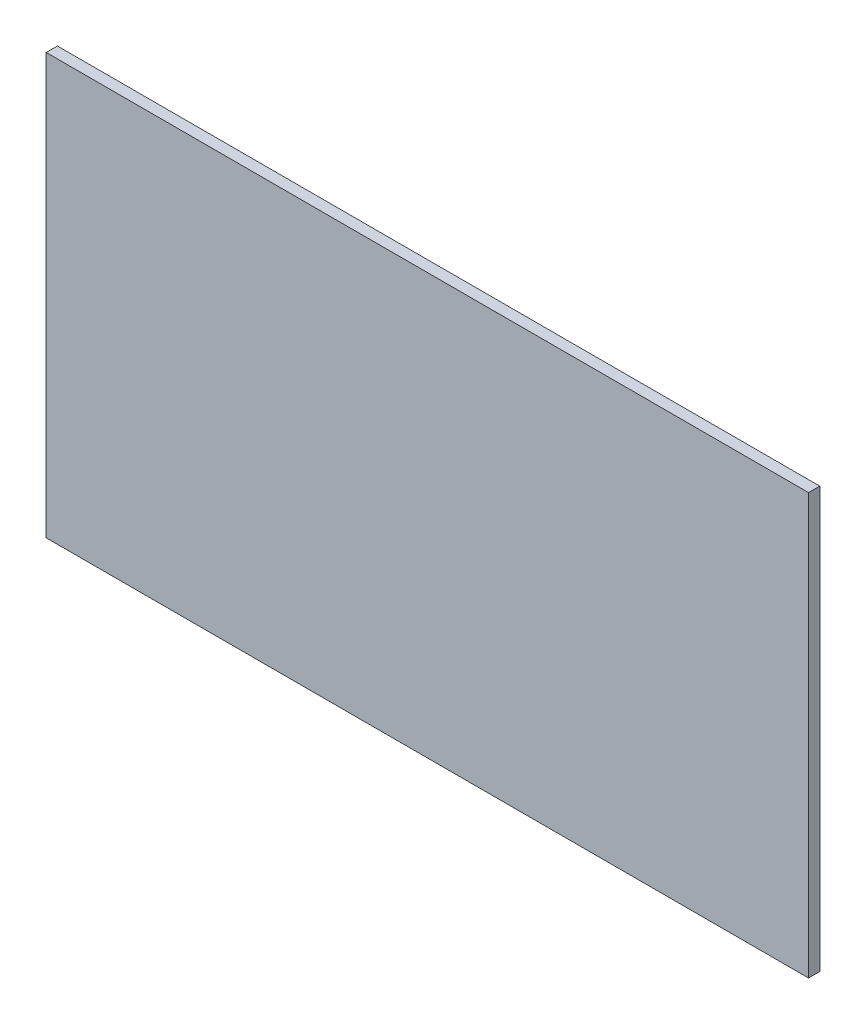
from build123d import *

# Parameters (mm, degrees)
SKETCH_1_W      = 272
SKETCH_1_H      = 150
EXTRUDE_1_DEPTH = 4


with BuildPart() as part:
    # 草图1 → 凸台-拉伸1 (new body)
    with BuildSketch(Plane.XY):
        Rectangle(SKETCH_1_W, SKETCH_1_H)
    extrude(amount=EXTRUDE_1_DEPTH)


solid = part.part
